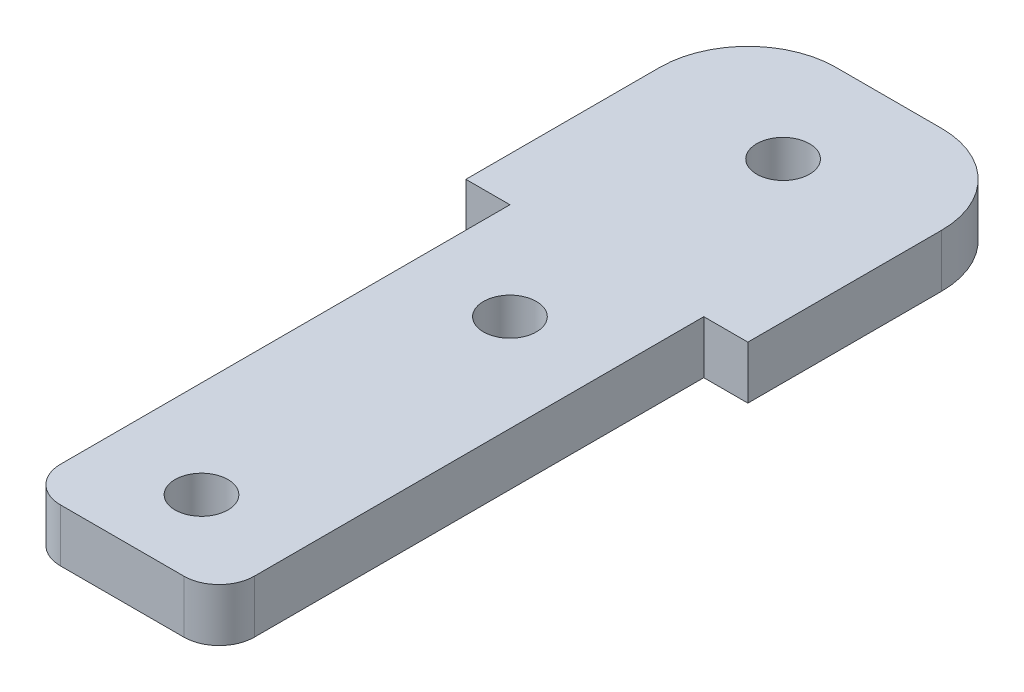
from build123d import *

# Parameters (mm, degrees)
SKETCH3_R           = 1.5
BOSS_EXTRUDE1_DEPTH = 3
BOSS_EXTRUDE2_DEPTH = 3
SKETCH5_R           = 1.5
CUT_EXTRUDE1_DEPTH  = 3


with BuildPart() as part:
    # Sketch3 → Boss-Extrude1 (new body)
    # profile 1 of 2: a face of its own
    with BuildSketch(Plane(origin=(0, 0, 0), x_dir=(1, 0, 0), z_dir=(0, 1, 0))):
        with BuildLine():
            Line((-6, 5), (6, 5))
            ThreePointArc((6, 5), (7.414213562, 4.414213562), (8, 3))
            Line((8, 3), (8, 0))
            Line((8, 0), (-8, 0))
            Line((-8, 0), (-8, 3))
            ThreePointArc((-8, 3), (-7.414213562, 4.414213562), (-6, 5))
        make_face()
    # profile 2 of 2: a face of its own
    with BuildSketch(Plane(origin=(0, 0, 0), x_dir=(1, 0, 0), z_dir=(0, 1, 0))):
        with BuildLine():
            Line((-5.5, 0), (5.5, 0))
            Line((5.5, 0), (5.5, -25.5))
            ThreePointArc((5.5, -25.5), (4.914213562, -26.914213562), (3.5, -27.5))
            Line((3.5, -27.5), (-3.5, -27.5))
            ThreePointArc((-3.5, -27.5), (-4.914213562, -26.914213562), (-5.5, -25.5))
            Line((-5.5, -25.5), (-5.5, 0))
        make_face()
        with Locations(Location((0, -5.5, 0), (0, 0, 270))):
            Circle(SKETCH3_R, mode=Mode.SUBTRACT)
        with Locations(Location((0, -23, 0), (0, 0, 270))):
            Circle(SKETCH3_R, mode=Mode.SUBTRACT)
    extrude(amount=BOSS_EXTRUDE1_DEPTH)

    # Sketch4 → Boss-Extrude2 (add)
    with BuildSketch(Plane(origin=(0, 3, 0), x_dir=(1, 0, 0), z_dir=(0, 1, 0))):
        with BuildLine():
            Line((-8, 0), (8, 0))
            Line((8, 0), (8, 11))
            ThreePointArc((8, 11), (6.535533906, 14.535533906), (3, 16))
            Line((3, 16), (-3, 16))
            ThreePointArc((-3, 16), (-6.535533906, 14.535533906), (-8, 11))
            Line((-8, 11), (-8, 0))
        make_face()
    extrude(amount=-BOSS_EXTRUDE2_DEPTH)

    # Sketch5 → Cut-Extrude1 (cut)
    with BuildSketch(Plane(origin=(0, 0, 0), x_dir=(-1, 0, 0), z_dir=(0, -1, 0))):
        with Locations(Location((0, 10, 0), (0, 0, 90))):
            Circle(SKETCH5_R)
    extrude(amount=-CUT_EXTRUDE1_DEPTH, mode=Mode.SUBTRACT)


solid = part.part
